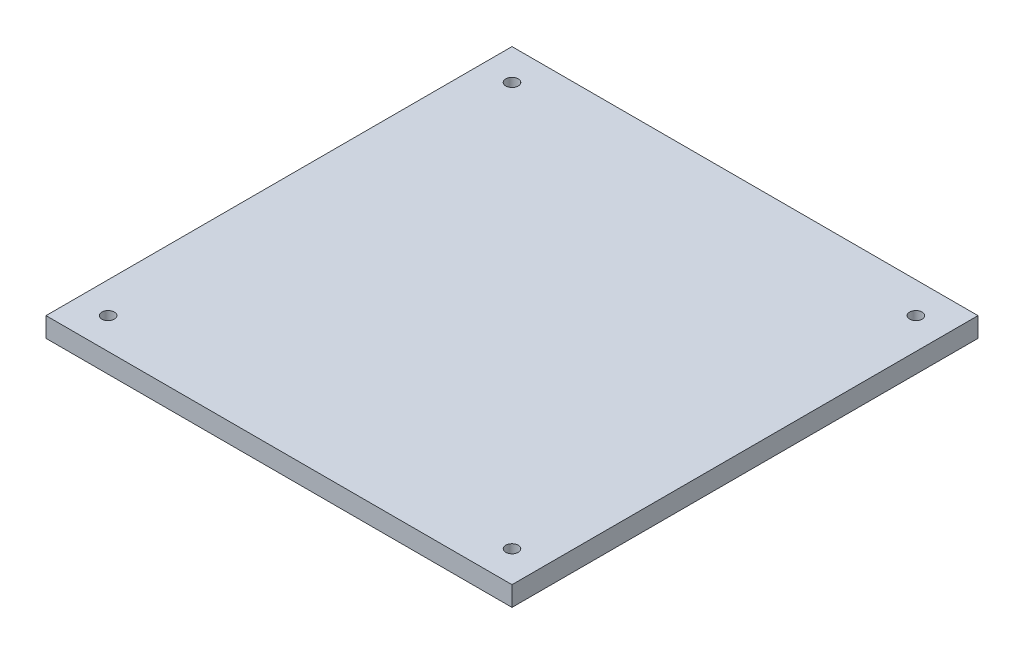
from build123d import *

# Parameters (mm, degrees)
ESBO_O1_W                    = 600
ESBO_O1_H                    = 600
RESSALTO_EXTRUS_O1_DEPTH     = 25.4
FURO_DE_DI_METRO_16_0_16_1_D = 16


with BuildPart() as part:
    # Esboço1 → Ressalto-extrusão1 (new body)
    with BuildSketch(Plane(origin=(0, 0, 0), x_dir=(1, 0, 0), z_dir=(0, 1, 0))):
        Rectangle(ESBO_O1_W, ESBO_O1_H)
    extrude(amount=RESSALTO_EXTRUS_O1_DEPTH)

    # Furo de diâmetro Ø16.0 (16)1 (through all)
    with Locations(Plane(origin=(0, 25.4, 0), x_dir=(1, 0, 0), z_dir=(0, 1, 0))):
        with Locations((-260, 260), (260, 260), (260, -260), (-260, -260)):
            Hole(FURO_DE_DI_METRO_16_0_16_1_D / 2)


solid = part.part
